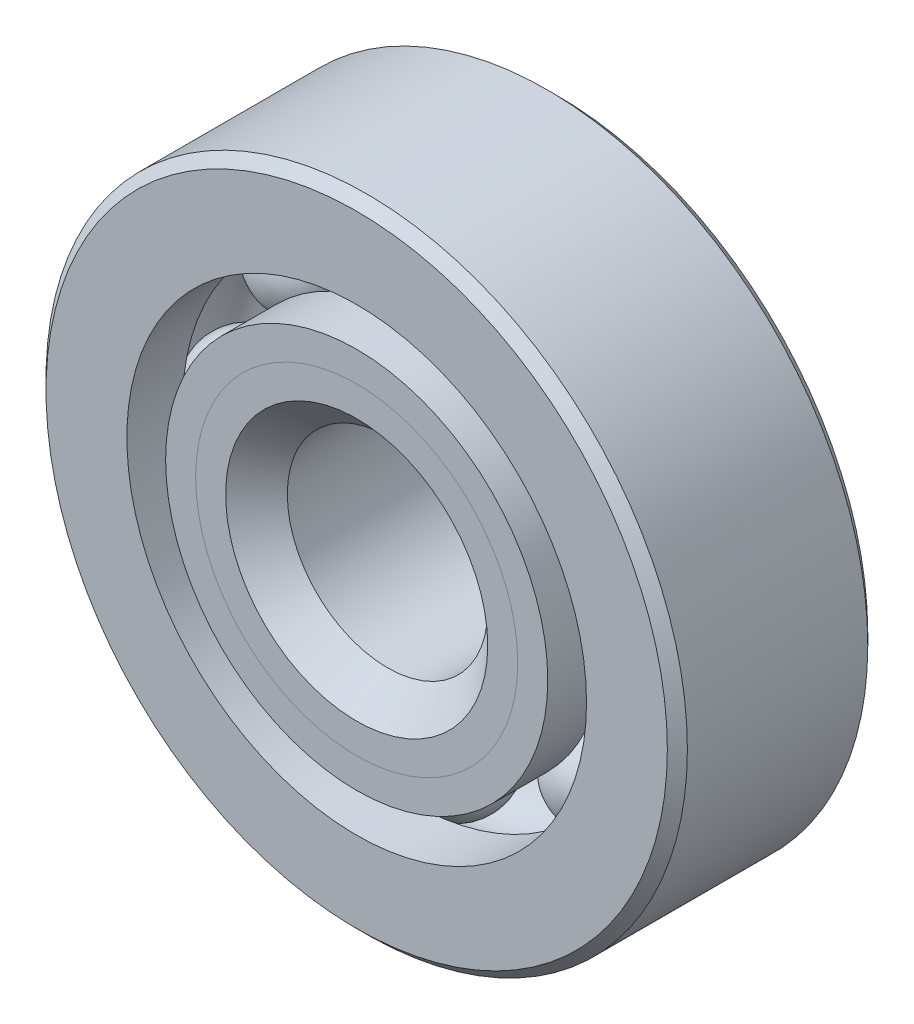
from build123d import *

# Parameters (mm, degrees)
CIRPATTERN1_COUNT = 8


with BuildPart() as part:
    # Sketch1 → Revolve1 (revolve)
    with BuildSketch(Plane(origin=(0, 0, 0), x_dir=(0, 0, -1), z_dir=(1, 0, 0))):
        with BuildLine():
            Line((2.25, 8), (-2.25, 8))
            Line((-2.25, 8), (-2.5, 7.75))
            Line((-2.5, 7.75), (-2.5, 5.733516484))
            Line((-2.5, 5.733516484), (-1.111111111, 5.733516484))
            ThreePointArc((-1.111111111, 5.733516484), (0, 6.461757439), (1.111111111, 5.733516484))
            Line((1.111111111, 5.733516484), (2.5, 5.733516484))
            Line((2.5, 5.733516484), (2.5, 7.75))
            Line((2.5, 7.75), (2.25, 8))
        make_face()
    revolve(axis=Axis((0, 0, 2.5), (0, 0, -1)))


with BuildPart() as body_2:
    # Sketch2 → Revolve2 (revolve)
    with BuildSketch(Plane(origin=(0, 0, 0), x_dir=(0, 0, -1), z_dir=(1, 0, 0))):
        with BuildLine():
            Line((-2.5, 4.766483516), (-1.111111111, 4.766483516))
            ThreePointArc((-1.111111111, 4.766483516), (-0.66424822, 4.236525583), (0, 4.038242561))
            Line((0, 4.038242561), (0, 3.26912128))
            Line((0, 3.26912128), (-1.751318882, 3.26912128))
            Line((-1.751318882, 3.26912128), (-2.5, 4.017802398))
            Line((-2.5, 4.017802398), (-2.5, 4.766483516))
        make_face()
    revolve(axis=Axis((0, 0, 2.5), (0, 0, -1)))


with BuildPart() as body_3:
    # Sketch3 → Revolve3 (revolve)
    with BuildSketch(Plane(origin=(0, 0, 0), x_dir=(0, 0, -1), z_dir=(1, 0, 0))):
        with BuildLine():
            Line((-2.5, 4.017802398), (-1.751318882, 3.26912128))
            Line((-1.751318882, 3.26912128), (0, 3.26912128))
            Line((0, 3.26912128), (0, 4.038242561))
            ThreePointArc((0, 4.038242561), (0.66424822, 4.236525583), (1.111111111, 4.766483516))
            Line((1.111111111, 4.766483516), (2.5, 4.766483516))
            Line((2.5, 4.766483516), (2.5, 2.75))
            Line((2.5, 2.75), (2.25, 2.5))
            Line((2.25, 2.5), (-1.73087872, 2.5))
            Line((-1.73087872, 2.5), (-2.5, 3.26912128))
            Line((-2.5, 3.26912128), (-2.5, 4.017802398))
        make_face()
    revolve(axis=Axis((0, 0, 2.5), (0, 0, -1)))


with BuildPart() as body_4:
    # Sketch4 → Revolve4 (revolve)
    with BuildSketch(Plane(origin=(0, 0, 0), x_dir=(0, 0, -1), z_dir=(1, 0, 0))):
        with BuildLine():
            Line((-1.211757439, 5.25), (1.211757439, 5.25))
            ThreePointArc((1.211757439, 5.25), (0, 6.461757439), (-1.211757439, 5.25))
        make_face()
    revolve(axis=Axis((0, 5.25, 1.211757439), (0, 0, -1)))


with BuildPart() as cirpattern1_1:
    # CirPattern1: pattern copy
    add(body_4.part.rotate(Axis((0, 0, -2.5), (0, 0, 1)), 1 * 360 / CIRPATTERN1_COUNT))


with BuildPart() as cirpattern1_2:
    # CirPattern1: pattern copy
    add(body_4.part.rotate(Axis((0, 0, -2.5), (0, 0, 1)), 2 * 360 / CIRPATTERN1_COUNT))


with BuildPart() as cirpattern1_3:
    # CirPattern1: pattern copy
    add(body_4.part.rotate(Axis((0, 0, -2.5), (0, 0, 1)), 3 * 360 / CIRPATTERN1_COUNT))


with BuildPart() as cirpattern1_4:
    # CirPattern1: pattern copy
    add(body_4.part.rotate(Axis((0, 0, -2.5), (0, 0, 1)), 4 * 360 / CIRPATTERN1_COUNT))


with BuildPart() as cirpattern1_5:
    # CirPattern1: pattern copy
    add(body_4.part.rotate(Axis((0, 0, -2.5), (0, 0, 1)), 5 * 360 / CIRPATTERN1_COUNT))


with BuildPart() as cirpattern1_6:
    # CirPattern1: pattern copy
    add(body_4.part.rotate(Axis((0, 0, -2.5), (0, 0, 1)), 6 * 360 / CIRPATTERN1_COUNT))


with BuildPart() as cirpattern1_7:
    # CirPattern1: pattern copy
    add(body_4.part.rotate(Axis((0, 0, -2.5), (0, 0, 1)), 7 * 360 / CIRPATTERN1_COUNT))


solid = Compound([part.part, body_2.part, body_3.part, body_4.part, cirpattern1_1.part, cirpattern1_2.part, cirpattern1_3.part, cirpattern1_4.part, cirpattern1_5.part, cirpattern1_6.part, cirpattern1_7.part])
